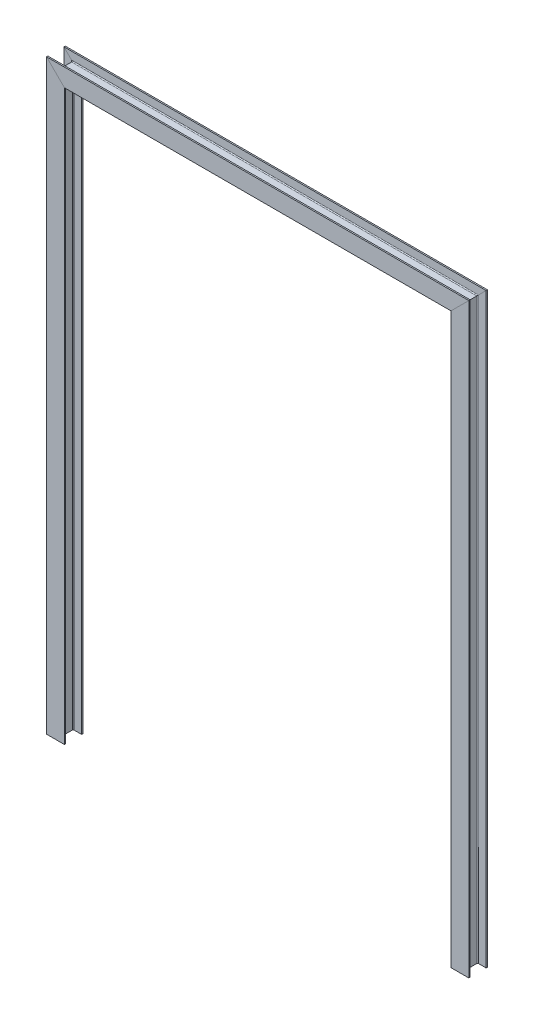
from build123d import *

# Parameters (mm, degrees)
W_SECTION_W12X96_1_DEPTH   = 10224.3935776
W_SECTION_W12X96_1_2_DEPTH = 7448.7871552
W_SECTION_W12X96_1_3_DEPTH = 10224.393577601


with BuildPart() as part:
    # Sketch11 → W section W12X96(1) (new body)
    with BuildSketch(Plane(origin=(0, 0, 0), x_dir=(-1, 0, 0), z_dir=(0, 1, 0))):
        with BuildLine():
            Line((-154.432, -161.417), (-154.432, -138.557))
            Line((-154.432, -138.557), (-22.225, -138.557))
            ThreePointArc((-22.225, -138.557), (-11.448692655, -134.093307345), (-6.985, -123.317))
            Line((-6.985, -123.317), (-6.985, 123.317))
            ThreePointArc((-6.985, 123.317), (-11.448692655, 134.093307345), (-22.225, 138.557))
            Line((-22.225, 138.557), (-154.432, 138.557))
            Line((-154.432, 138.557), (-154.432, 161.417))
            Line((-154.432, 161.417), (154.432, 161.417))
            Line((154.432, 161.417), (154.432, 138.557))
            Line((154.432, 138.557), (22.225, 138.557))
            ThreePointArc((22.225, 138.557), (11.448692655, 134.093307345), (6.985, 123.317))
            Line((6.985, 123.317), (6.985, -123.317))
            ThreePointArc((6.985, -123.317), (11.448692655, -134.093307345), (22.225, -138.557))
            Line((22.225, -138.557), (154.432, -138.557))
            Line((154.432, -138.557), (154.432, -161.417))
            Line((154.432, -161.417), (-154.432, -161.417))
        make_face()
    extrude(amount=W_SECTION_W12X96_1_DEPTH)

    # W section W12X96(1) mitre 1
    split(bisect_by=Plane(origin=(0, 10000, 0), x_dir=(0.707106781, -0.707106781, 0), z_dir=(-0.707106781, -0.707106781, 0)), keep=Keep.TOP)


with BuildPart() as body_2:
    # Sketch11 on segment 2 (carried to segment 2) → W section W12X96_1 2 (new body)
    with BuildSketch(Plane(origin=(-224.3935776, 10000, 0), x_dir=(0, 1, 0), z_dir=(1, 0, 0))):
        with BuildLine():
            Line((-154.432, -161.417), (-154.432, -138.557))
            Line((-154.432, -138.557), (-22.225, -138.557))
            ThreePointArc((-22.225, -138.557), (-11.448692655, -134.093307345), (-6.985, -123.317))
            Line((-6.985, -123.317), (-6.985, 123.317))
            ThreePointArc((-6.985, 123.317), (-11.448692655, 134.093307345), (-22.225, 138.557))
            Line((-22.225, 138.557), (-154.432, 138.557))
            Line((-154.432, 138.557), (-154.432, 161.417))
            Line((-154.432, 161.417), (154.432, 161.417))
            Line((154.432, 161.417), (154.432, 138.557))
            Line((154.432, 138.557), (22.225, 138.557))
            ThreePointArc((22.225, 138.557), (11.448692655, 134.093307345), (6.985, 123.317))
            Line((6.985, 123.317), (6.985, -123.317))
            ThreePointArc((6.985, -123.317), (11.448692655, -134.093307345), (22.225, -138.557))
            Line((22.225, -138.557), (154.432, -138.557))
            Line((154.432, -138.557), (154.432, -161.417))
            Line((154.432, -161.417), (-154.432, -161.417))
        make_face()
    extrude(amount=W_SECTION_W12X96_1_2_DEPTH)

    # W section W12X96_1 2 mitre 1
    split(bisect_by=Plane(origin=(0, 10000, 0), x_dir=(-0.707106781, 0.707106781, 0), z_dir=(0.707106781, 0.707106781, 0)), keep=Keep.TOP)

    # W section W12X96_1 2 mitre 2
    split(bisect_by=Plane(origin=(7000, 10000, 0), x_dir=(-0.707106781, -0.707106781, 0), z_dir=(-0.707106781, 0.707106781, 0)), keep=Keep.TOP)


with BuildPart() as body_3:
    # Sketch11 on segment 3 (carried to segment 3) → W section W12X96_1 3 (new body)
    with BuildSketch(Plane(origin=(7000, 10224.3935776, 0), x_dir=(1, 0, 0), z_dir=(0, -1, 0))):
        with BuildLine():
            Line((-154.432, -161.417), (-154.432, -138.557))
            Line((-154.432, -138.557), (-22.225, -138.557))
            ThreePointArc((-22.225, -138.557), (-11.448692655, -134.093307345), (-6.985, -123.317))
            Line((-6.985, -123.317), (-6.985, 123.317))
            ThreePointArc((-6.985, 123.317), (-11.448692655, 134.093307345), (-22.225, 138.557))
            Line((-22.225, 138.557), (-154.432, 138.557))
            Line((-154.432, 138.557), (-154.432, 161.417))
            Line((-154.432, 161.417), (154.432, 161.417))
            Line((154.432, 161.417), (154.432, 138.557))
            Line((154.432, 138.557), (22.225, 138.557))
            ThreePointArc((22.225, 138.557), (11.448692655, 134.093307345), (6.985, 123.317))
            Line((6.985, 123.317), (6.985, -123.317))
            ThreePointArc((6.985, -123.317), (11.448692655, -134.093307345), (22.225, -138.557))
            Line((22.225, -138.557), (154.432, -138.557))
            Line((154.432, -138.557), (154.432, -161.417))
            Line((154.432, -161.417), (-154.432, -161.417))
        make_face()
    extrude(amount=W_SECTION_W12X96_1_3_DEPTH)

    # W section W12X96_1 3 mitre 1
    split(bisect_by=Plane(origin=(7000, 10000, 0), x_dir=(0.707106781, 0.707106781, 0), z_dir=(0.707106781, -0.707106781, 0)), keep=Keep.TOP)


solid = Compound([part.part, body_2.part, body_3.part])
